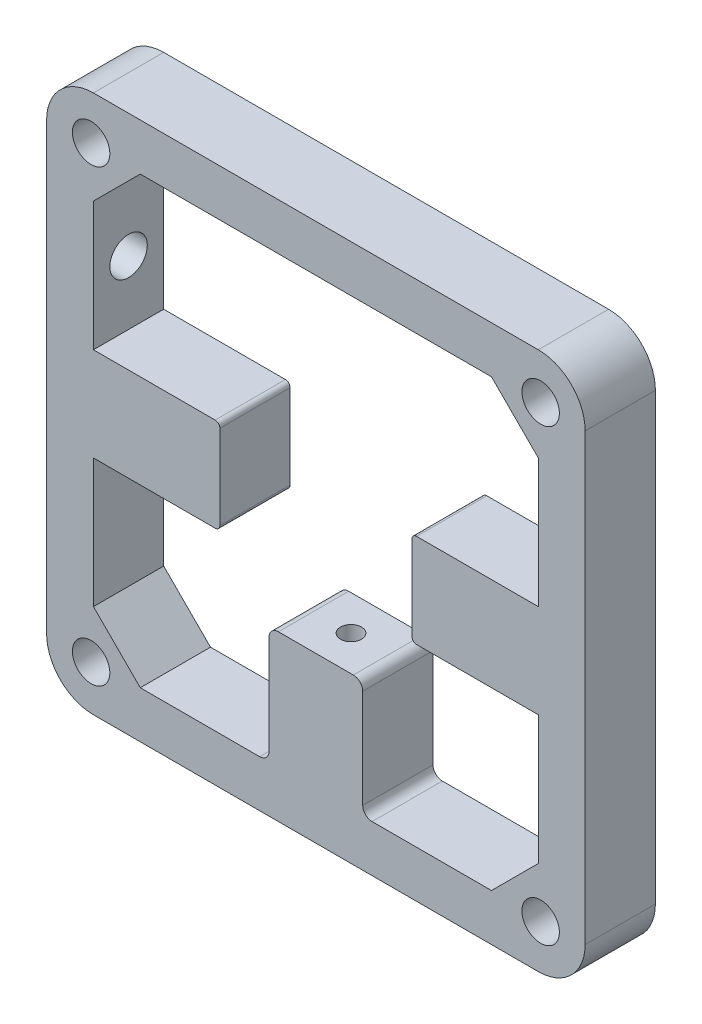
from build123d import *

# Parameters (mm, degrees)
SKETCH1_W           = 115
SKETCH1_H           = 115
SKETCH1_W_2         = 95
SKETCH1_H_2         = 95
BOSS_EXTRUDE1_DEPTH = 15
SKETCH10_W          = 20
SKETCH10_H          = 15
BOSS_EXTRUDE4_DEPTH = 27
SKETCH3_W           = 11
SKETCH3_H           = 10
CUT_EXTRUDE1_DEPTH  = 28
FILLET1_R           = 10
CHAMFER1_SIZE       = 10
SKETCH4_R           = 4
CUT_EXTRUDE3_DEPTH  = 57.5
SKETCH9_R           = 4
CUT_EXTRUDE7_DEPTH  = 30
FILLET6_R           = 2
SKETCH11_R          = 2.25
CUT_EXTRUDE8_DEPTH  = 30
SKETCH12_W          = 95
SKETCH12_H          = 20
BOSS_EXTRUDE5_DEPTH = 15
SKETCH13_W          = 41
SKETCH13_H          = 27.815570672
CUT_EXTRUDE9_DEPTH  = 20
FILLET7_R           = 1


with BuildPart() as part:
    # Sketch1 → Boss-Extrude1 (new body)
    with BuildSketch(Plane.XY.offset(-13)):
        Rectangle(SKETCH1_W, SKETCH1_H)
        Rectangle(SKETCH1_W_2, SKETCH1_H_2, mode=Mode.SUBTRACT)
    extrude(amount=BOSS_EXTRUDE1_DEPTH)

    # Sketch10 → Boss-Extrude4 (add)
    with BuildSketch(Plane(origin=(0, -22.4, 0), x_dir=(1, 0, 0), z_dir=(0, 1, 0))):
        with Locations((0, 5.5)):
            Rectangle(SKETCH10_W, SKETCH10_H)
    extrude(amount=-BOSS_EXTRUDE4_DEPTH)

    # Sketch3 → Cut-Extrude1 (cut)
    with BuildSketch(Plane(origin=(0, -57.5, 0), x_dir=(-1, 0, 0), z_dir=(0, -1, 0))):
        with Locations((0, 5.5)):
            Rectangle(SKETCH3_W, SKETCH3_H)
    extrude(amount=-CUT_EXTRUDE1_DEPTH, mode=Mode.SUBTRACT)

    # Fillet1
    fillet1_edges = [part.edges().sort_by_distance(p)[0] for p in [
        (-57.5, 57.5, -5.5),
        (57.5, 57.5, -5.5),
        (57.5, -57.5, -5.5),
        (-57.5, -57.5, -5.5),
    ]]
    fillet(fillet1_edges, radius=FILLET1_R)

    # Chamfer1
    chamfer1_edges = [part.edges().sort_by_distance(p)[0] for p in [
        (-47.5, 47.5, -5.5),
        (-47.5, -47.5, -5.5),
        (47.5, -47.5, -5.5),
        (47.5, 47.5, -5.5),
    ]]
    chamfer(chamfer1_edges, length=CHAMFER1_SIZE)

    # Sketch4 → Cut-Extrude3 (cut, symmetric)
    with BuildSketch(Plane.XY):
        with Locations(Location((-48, 48, 0), (0, 0, 180))):
            Circle(SKETCH4_R)
        with Locations(Location((48, 48, 0), (0, 0, 180))):
            Circle(SKETCH4_R)
        with Locations(Location((48, -48, 0), (0, 0, 180))):
            Circle(SKETCH4_R)
        with Locations(Location((-48, -48, 0), (0, 0, 180))):
            Circle(SKETCH4_R)
    extrude(amount=CUT_EXTRUDE3_DEPTH, both=True, mode=Mode.SUBTRACT)

    # Sketch9 → Cut-Extrude7 (cut)
    with BuildSketch(Plane.ZY.offset(57.5)):
        with Locations(Location((-5.5, 23.6, 0), (0, 0, 270))):
            Circle(SKETCH9_R)
    extrude(amount=-CUT_EXTRUDE7_DEPTH, mode=Mode.SUBTRACT)

    # Fillet6
    fillet6_edges = [part.edges().sort_by_distance(p)[0] for p in [
        (10, -47.5, -5.5),
        (-10, -47.5, -5.5),
        (-10, -22.4, -5.5),
        (10, -22.4, -5.5),
    ]]
    fillet(fillet6_edges, radius=FILLET6_R)

    # Sketch11 → Cut-Extrude8 (cut)
    with BuildSketch(Plane(origin=(0, -29.5, 0), x_dir=(-1, 0, 0), z_dir=(0, -1, 0))):
        with Locations(Location((0, 5.5, 0), (0, 0, 90))):
            Circle(SKETCH11_R)
    extrude(amount=-CUT_EXTRUDE8_DEPTH, mode=Mode.SUBTRACT)

    # Sketch12 → Boss-Extrude5 (add)
    with BuildSketch(Plane.XY.offset(2)):
        Rectangle(SKETCH12_W, SKETCH12_H)
    extrude(amount=-BOSS_EXTRUDE5_DEPTH)

    # Sketch13 → Cut-Extrude9 (cut)
    with BuildSketch(Plane.XY.offset(2)):
        Rectangle(SKETCH13_W, SKETCH13_H)
    extrude(amount=-CUT_EXTRUDE9_DEPTH, mode=Mode.SUBTRACT)

    # Fillet7
    fillet7_edges = [part.edges().sort_by_distance(p)[0] for p in [
        (-20.5, -10, -5.5),
        (20.5, -10, -5.5),
        (20.5, 10, -5.5),
        (-20.5, 10, -5.5),
    ]]
    fillet(fillet7_edges, radius=FILLET7_R)


solid = part.part
